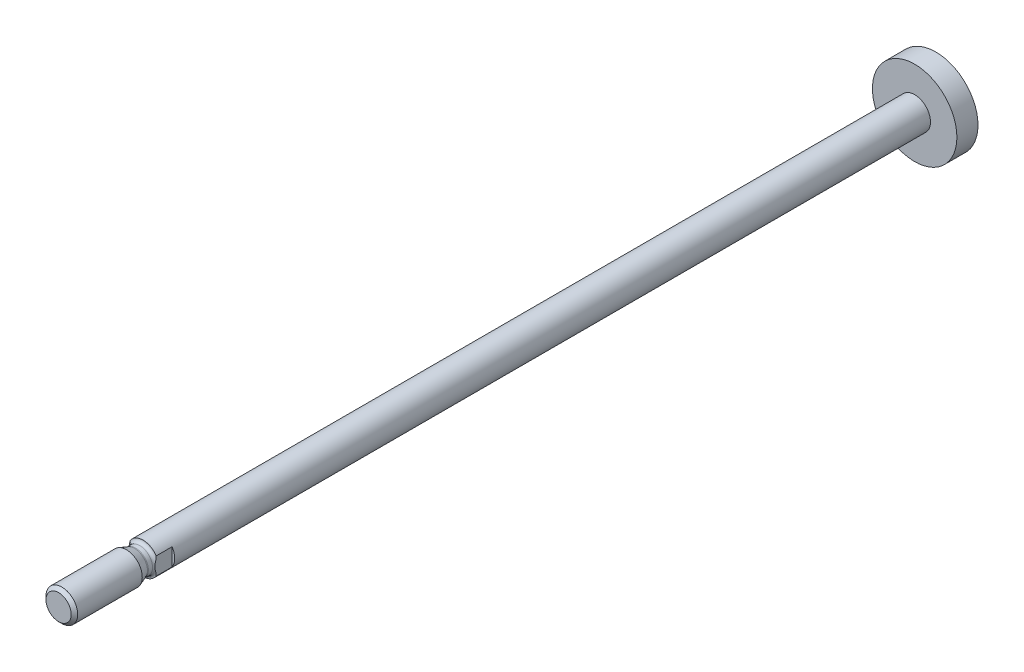
from build123d import *

# Parameters (mm, degrees)
SCHNITT_LINEAR_AUSTRAGEN1_DEPTH = 4


with BuildPart() as part:
    # Skizze1 → Rotation1 (revolve)
    with BuildSketch(Plane(origin=(0, 0, 0), x_dir=(0, 0, -1), z_dir=(1, 0, 0))):
        Polygon((-5, 0), (-5, 3), (141.2, 3), (141.2, 8), (145.2, 8), (145.2, 0), align=None)
    revolve(axis=Axis((0, 0, -145.2), (0, 0, 1)))

    # Skizze2 → Rotation2 (revolve)
    with BuildSketch(Plane(origin=(0, 0, 0), x_dir=(0, 0, -1), z_dir=(1, 0, 0))):
        with BuildLine():
            Line((-21, 0), (-21, 2.3865))
            Line((-21, 2.3865), (-20.3865, 3))
            Line((-20.3865, 3), (-8.148486452, 3))
            Line((-8.148486452, 3), (-6.599415898, 2.436184428))
            ThreePointArc((-6.599415898, 2.436184428), (-6.498392718, 2.409115348), (-6.394203812, 2.4))
            Line((-6.394203812, 2.4), (-5.6, 2.4))
            ThreePointArc((-5.6, 2.4), (-5.175735931, 2.575735931), (-5, 3))
            Line((-5, 3), (-4, 3))
            Line((-4, 3), (-4, 0))
            Line((-4, 0), (-21, 0))
        make_face()
    revolve(axis=Axis((0, 0, 4), (0, 0, 1)))

    # Skizze3 → Schnitt-Linear austragen1 (cut)
    with BuildSketch(Plane.XY.offset(2)):
        Polygon((-5, 10), (-5, -5), (-2.5, -5), (-2.5, 5), (2.5, 5), (2.5, -5), (5, -5), (5, 10), align=None)
    extrude(amount=SCHNITT_LINEAR_AUSTRAGEN1_DEPTH, mode=Mode.SUBTRACT)


solid = part.part
